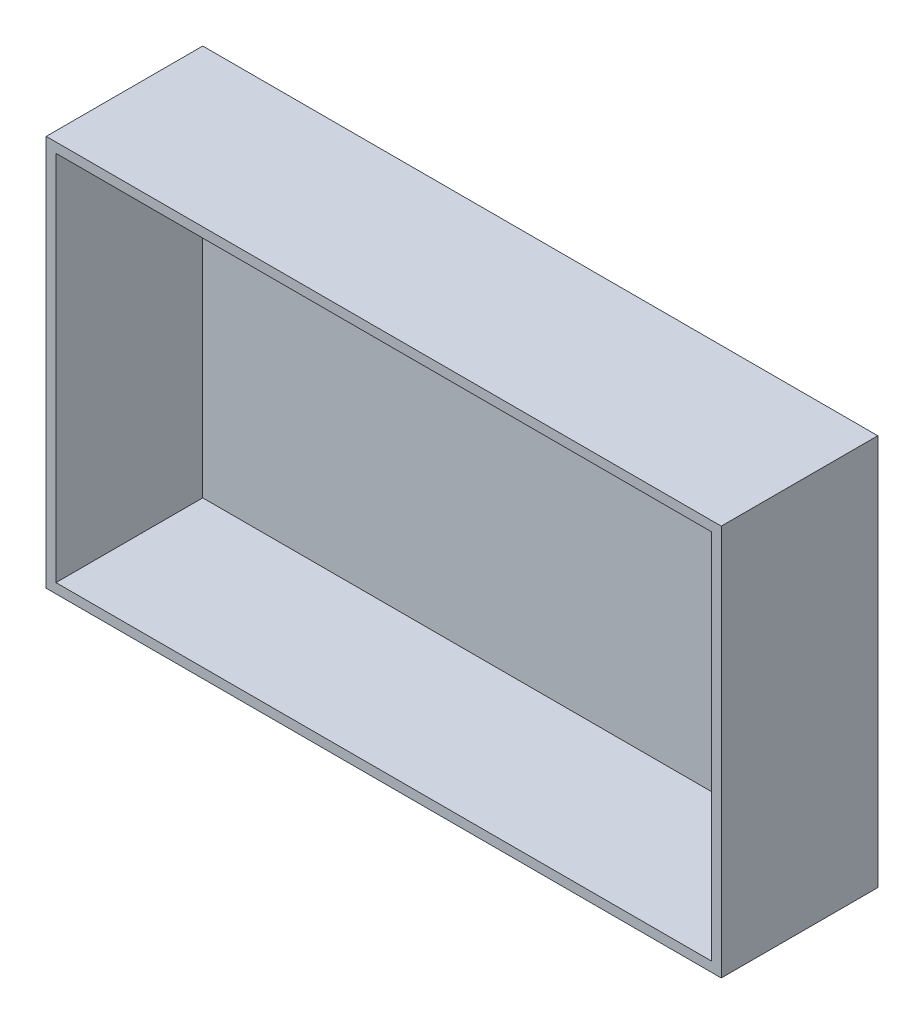
from build123d import *

# Parameters (mm, degrees)
SCHIZZO1_W                   = 690
SCHIZZO1_H                   = 400
ESTRUSIONE_ESTRUSIONE1_DEPTH = 10
SCHIZZO2_W                   = 690
SCHIZZO2_H                   = 400
SCHIZZO2_W_2                 = 670
SCHIZZO2_H_2                 = 380
ESTRUSIONE_ESTRUSIONE2_DEPTH = 150


with BuildPart() as part:
    # Schizzo1 → Estrusione-Estrusione1 (new body)
    with BuildSketch(Plane.XY):
        Rectangle(SCHIZZO1_W, SCHIZZO1_H)
    extrude(amount=ESTRUSIONE_ESTRUSIONE1_DEPTH)

    # Schizzo2 → Estrusione-Estrusione2 (add)
    with BuildSketch(Plane.XY.offset(10)):
        Rectangle(SCHIZZO2_W, SCHIZZO2_H)
        Rectangle(SCHIZZO2_W_2, SCHIZZO2_H_2, mode=Mode.SUBTRACT)
    extrude(amount=ESTRUSIONE_ESTRUSIONE2_DEPTH)


solid = part.part
